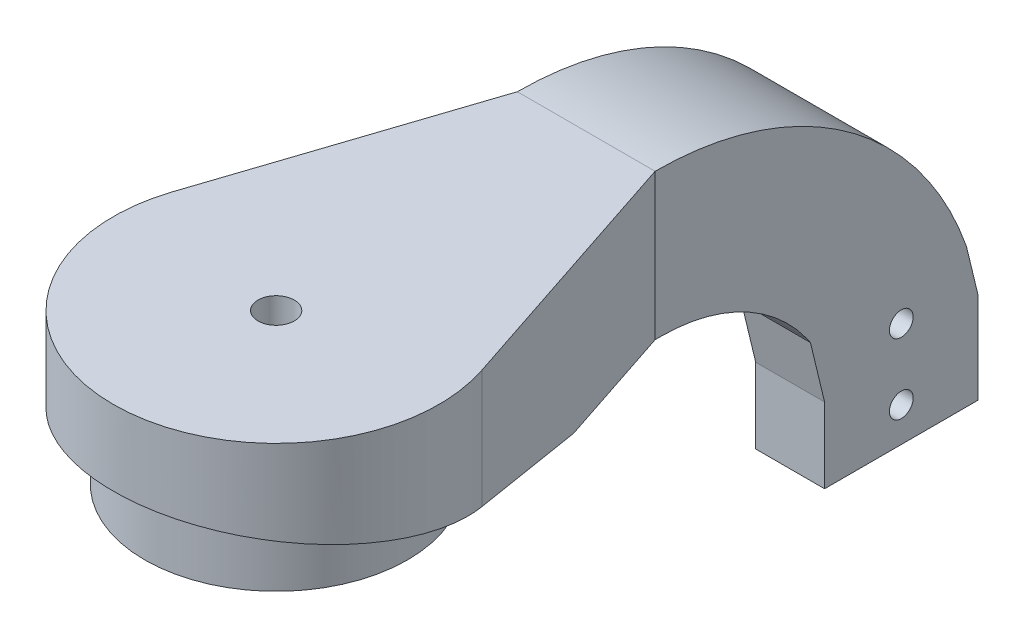
from build123d import *

# Parameters (mm, degrees)
CROQUIS1_R              = 21
SALIENTE_EXTRUIR1_DEPTH = 24
CROQUIS2_R              = 2.9
CORTAR_EXTRUIR1_DEPTH   = 30
CROQUIS3_R              = 26
SALIENTE_EXTRUIR2_DEPTH = 12
SALIENTE_EXTRUIR3_DEPTH = 26
CROQUIS6_W              = 19.429
CROQUIS6_H              = 23.308672713
SALIENTE_EXTRUIR4_DEPTH = 52
CORTAR_EXTRUIR2_DEPTH   = 61.862693955
SALIENTE_EXTRUIR5_DEPTH = 11
SALIENTE_EXTRUIR6_DEPTH = 11
CROQUIS10_R             = 1.9
CORTAR_EXTRUIR3_DEPTH   = 110.615590995
CROQUIS11_R             = 2.9
CORTAR_EXTRUIR4_DEPTH   = 120.153595066
CORTAR_EXTRUIR5_DEPTH   = 4


with BuildPart() as part:
    # Croquis1 → Saliente-Extruir1 (new body)
    with BuildSketch(Plane(origin=(0, 0, 0), x_dir=(1, 0, 0), z_dir=(0, 1, 0))):
        with Locations(Location((0, 0, 0), (0, 0, 270))):
            Circle(CROQUIS1_R)
    extrude(amount=SALIENTE_EXTRUIR1_DEPTH)

    # Croquis2 → Cortar-Extruir1 (cut, symmetric)
    with BuildSketch(Plane(origin=(0, 24, 0), x_dir=(1, 0, 0), z_dir=(0, 1, 0))):
        with Locations(Location((0, 0, 0), (0, 0, 270))):
            Circle(CROQUIS2_R)
    extrude(amount=CORTAR_EXTRUIR1_DEPTH, both=True, mode=Mode.SUBTRACT)

    # Croquis3 → Saliente-Extruir2 (add)
    with BuildSketch(Plane(origin=(0, 24, 0), x_dir=(1, 0, 0), z_dir=(0, 1, 0))):
        with Locations(Location((0, 0, 0), (0, 0, 270))):
            Circle(CROQUIS3_R)
    extrude(amount=-SALIENTE_EXTRUIR2_DEPTH)

    # Croquis4 → Saliente-Extruir3 (add, symmetric)
    with BuildSketch(Plane(origin=(0, 0, 0), x_dir=(0, 0, -1), z_dir=(1, 0, 0))):
        Polygon((-26, 13.930297777), (-26, 12), (30.091374751, 0.691327287), (30.091374751, 24), (-26, 24), align=None)
    extrude(amount=SALIENTE_EXTRUIR3_DEPTH, both=True)

    # Croquis6 → Saliente-Extruir4 (add)
    with BuildSketch(Plane(origin=(26, 0, 0), x_dir=(0, 0, -1), z_dir=(1, 0, 0))):
        with Locations((39.805874751, 12.345663644)):
            Rectangle(CROQUIS6_W, CROQUIS6_H)
    extrude(amount=-SALIENTE_EXTRUIR4_DEPTH)

    # Croquis5 → Cortar-Extruir2 (cut, through all)
    with BuildSketch(Plane(origin=(0, 24, 0), x_dir=(1, 0, 0), z_dir=(0, 1, 0))):
        with BuildLine():
            Line((-31.296292427, 177.340731999), (24.68369475, 8.167938142))
            ThreePointArc((24.68369475, 8.167938142), (0, -26), (-24.68369475, 8.167938142))
            Line((-24.68369475, 8.167938142), (-11, 49.520374751))
            Line((-11, 49.520374751), (11, 49.520374751))
            Line((11, 49.520374751), (24.68369475, 8.167938142))
            Line((24.68369475, 8.167938142), (26, 49.520374751))
            Line((26, 49.520374751), (11, 49.520374751))
            Line((11, 49.520374751), (-167.194256769, 49.520374751))
            Line((-167.194256769, 49.520374751), (76.977143024, -210.081435923))
            Line((76.977143024, -210.081435923), (212.875107366, -82.261078675))
            Line((212.875107366, -82.261078675), (-31.296292427, 177.340731999))
        make_face()
    extrude(amount=-CORTAR_EXTRUIR2_DEPTH, mode=Mode.SUBTRACT)


with BuildPart() as cortar_extruir2_kept_piece:
    # of the separate pieces the step leaves, the one the design keeps (cortar_extruir2_pieces_kept)
    add(part.part.solids().sort_by_distance((0, 0, 21))[0])

    # Croquis7 → Saliente-Extruir5 (add, symmetric)
    with BuildSketch(Plane(origin=(0, 0, 0), x_dir=(0, 0, -1), z_dir=(1, 0, 0))):
        with BuildLine():
            Line((49.520374751, 24), (49.520374751, 0.691327287))
            Line((49.520374751, 0.691327287), (50.478144868, 0.691327287))
            ThreePointArc((50.478144868, 0.691327287), (63.55673371, -2.469267031), (73.748722442, -11.253469229))
            Line((73.748722442, -11.253469229), (99.248722442, -11.253469229))
            ThreePointArc((99.248722442, -11.253469229), (79.998709912, 14.292570123), (49.520374751, 24))
        make_face()
    extrude(amount=SALIENTE_EXTRUIR5_DEPTH, both=True)

    # Croquis9 → Saliente-Extruir6 (add)
    with BuildSketch(Plane(origin=(11, 0, 0), x_dir=(0, 0, -1), z_dir=(1, 0, 0))):
        with BuildLine():
            Line((101.09458803, -18.883363084), (99.248722442, -11.253469229))
            Line((99.248722442, -11.253469229), (73.748722442, -11.253469229))
            ThreePointArc((73.748722483, -11.2534692), (74.042597019, -11.670890415), (74.32898512, -12.093483089))
            ThreePointArc((74.32898512, -12.093483089), (77.894859555, -19.667595219), (79.118326526, -27.949247445))
            ThreePointArc((79.118326526, -27.949247445), (78.984304271, -30.716755499), (78.583491791, -33.458363084))
            Line((78.583491791, -33.458363084), (101.09458803, -33.458363084))
            Line((101.09458803, -33.458363084), (101.09458803, -18.883363084))
        make_face()
        with BuildLine():
            ThreePointArc((79.118326526, -27.949247445), (77.894859555, -19.667595219), (74.32898512, -12.093483089))
            Line((74.32898512, -12.093483089), (76.59458803, -21.458363084))
            Line((76.59458803, -21.458363084), (76.59458803, -33.458363084))
            Line((76.59458803, -33.458363084), (78.583491791, -33.458363084))
            ThreePointArc((78.583491791, -33.458363084), (78.984304271, -30.716755499), (79.118326526, -27.949247445))
        make_face()
    extrude(amount=-SALIENTE_EXTRUIR6_DEPTH)

    # Croquis10 → Cortar-Extruir3 (cut, through all)
    with BuildSketch(Plane.ZY):
        with Locations((-88.84458803, -27.958363084)):
            Circle(CROQUIS10_R)
        with Locations((-88.84458803, -16.728363084)):
            Circle(CROQUIS10_R)
    extrude(amount=-CORTAR_EXTRUIR3_DEPTH, mode=Mode.SUBTRACT)

    # Croquis11 → Cortar-Extruir4 (cut, through all)
    with BuildSketch(Plane(origin=(0, 24, 0), x_dir=(1, 0, 0), z_dir=(0, 1, 0))):
        with Locations(Location((0, 0, 0), (0, 0, 270))):
            Circle(CROQUIS11_R)
    extrude(amount=-CORTAR_EXTRUIR4_DEPTH, mode=Mode.SUBTRACT)

    # Croquis12 → Cortar-Extruir5 (cut)
    with BuildSketch(Plane.XZ):
        Polygon((2.825, 4.893043531), (-2.825, 4.893043531), (-5.65, 0), (-2.825, -4.893043531), (2.825, -4.893043531), (5.65, 0), align=None)
    extrude(amount=-CORTAR_EXTRUIR5_DEPTH, mode=Mode.SUBTRACT)


solid = cortar_extruir2_kept_piece.part
